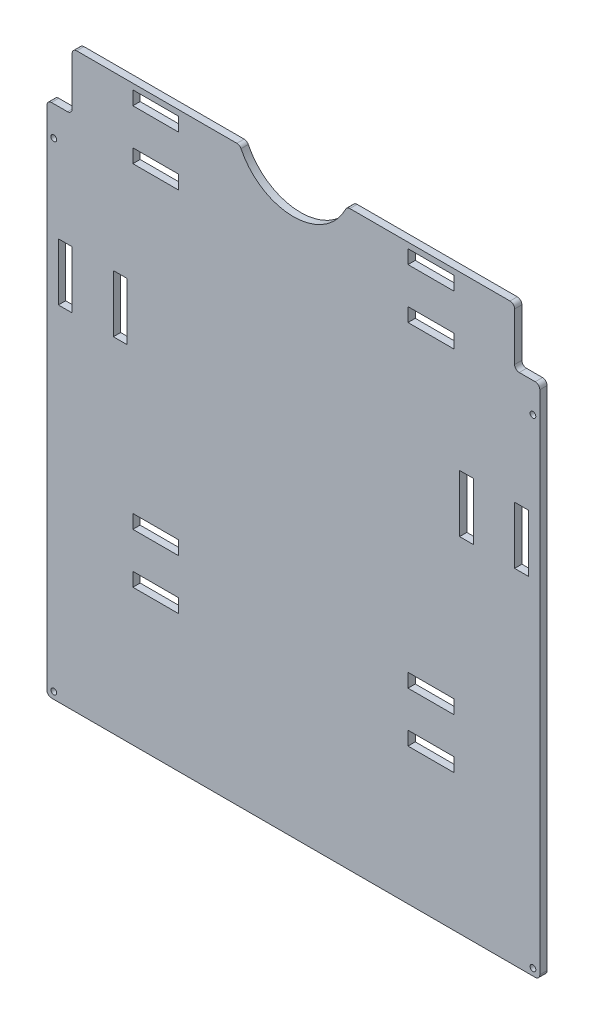
from build123d import *

# Parameters (mm, degrees)
SKETCH1_W                 = 215
SKETCH1_H                 = 250
BOSS_EXTRUDE1_DEPTH       = 3.175
SKETCH2_R                 = 25.4
CUT_EXTRUDE1_DEPTH        = 165.897940027
SKETCH3_W                 = 11
SKETCH3_H                 = 25
CUT_EXTRUDE2_DEPTH        = 165.897940027
FILLET1_R                 = 2
SKETCH4_W                 = 20
SKETCH4_H                 = 6
CUT_EXTRUDE3_DEPTH        = 165.897940027
LPATTERN1_COUNT           = 2
LPATTERN1_PITCH           = 160
LPATTERN1_COPY_1_SKETCH_W = 20
LPATTERN1_COPY_1_SKETCH_H = 6
LPATTERN1_COPY_1_DEPTH    = 165.897940027
M3X0_5_TAPPED_HOLE1_D     = 2.5
SKETCH9_W                 = 6
SKETCH9_H                 = 25
CUT_EXTRUDE4_DEPTH        = 165.897940027


with BuildPart() as part:
    # Sketch1 → Boss-Extrude1 (new body)
    with BuildSketch(Plane.XY):
        Rectangle(SKETCH1_W, SKETCH1_H)
    extrude(amount=BOSS_EXTRUDE1_DEPTH)

    # Sketch2 → Cut-Extrude1 (cut, through all)
    with BuildSketch(Plane.XY.offset(3.175)):
        with Locations((0, 135)):
            Circle(SKETCH2_R)
    extrude(amount=-CUT_EXTRUDE1_DEPTH, mode=Mode.SUBTRACT)

    # Sketch3 → Cut-Extrude2 (cut, through all)
    with BuildSketch(Plane.XY.offset(3.175)):
        with Locations((-102, 112.5)):
            Rectangle(SKETCH3_W, SKETCH3_H)
    cut_extrude2 = extrude(amount=-CUT_EXTRUDE2_DEPTH, mode=Mode.SUBTRACT)

    # Mirror1: Cut-Extrude2 across plane
    add(cut_extrude2.mirror(Plane(origin=(0, 0, 0), x_dir=(0, 0, 1), z_dir=(1, 0, 0))), mode=Mode.SUBTRACT)

    # Fillet1
    fillet1_edges = [part.edges().sort_by_distance(p)[0] for p in [
        (23.348661632, 125, 1.5875),
        (-23.348661632, 125, 1.5875),
        (-107.5, 100, 1.5875),
        (-96.5, 125, 1.5875),
        (-96.5, 100, 1.5875),
        (107.5, 100, 1.5875),
        (96.5, 100, 1.5875),
        (96.5, 125, 1.5875),
        (107.5, -125, 1.5875),
        (-107.5, -125, 1.5875),
    ]]
    fillet(fillet1_edges, radius=FILLET1_R)

    # Sketch4 → Cut-Extrude3 (cut, through all)
    with BuildSketch(Plane(origin=(0, 0, 0), x_dir=(-1, 0, 0), z_dir=(0, 0, -1))):
        with Locations((-60, -40.5)):
            Rectangle(SKETCH4_W, SKETCH4_H)
        with Locations((-60, -62.375)):
            Rectangle(SKETCH4_W, SKETCH4_H)
    cut_extrude3 = extrude(amount=-CUT_EXTRUDE3_DEPTH, mode=Mode.SUBTRACT)

    # Mirror2: Cut-Extrude3 across plane
    add(cut_extrude3.mirror(Plane(origin=(0, 0, 0), x_dir=(0, 0, 1), z_dir=(1, 0, 0))), mode=Mode.SUBTRACT)

    # LPattern1: Cut-Extrude3 ×2
    with Locations(*[(0, i * LPATTERN1_PITCH, 0) for i in range(1, LPATTERN1_COUNT)]):
        add(cut_extrude3, mode=Mode.SUBTRACT)

    # LPattern1 copy 1 sketch → LPattern1 copy 1 (cut, through all)
    with BuildSketch(Plane(origin=(0, 160, 0), x_dir=(1, 0, 0), z_dir=(0, 0, -1))):
        with Locations((-60, 40.5)):
            Rectangle(LPATTERN1_COPY_1_SKETCH_W, LPATTERN1_COPY_1_SKETCH_H)
        with Locations((-60, 62.375)):
            Rectangle(LPATTERN1_COPY_1_SKETCH_W, LPATTERN1_COPY_1_SKETCH_H)
    extrude(amount=-LPATTERN1_COPY_1_DEPTH, mode=Mode.SUBTRACT)

    # M3x0.5 Tapped Hole1 (through all)
    with Locations(Plane(origin=(0, 0, 0), x_dir=(-1, 0, 0), z_dir=(0, 0, -1))):
        with Locations((-104.5, 87), (104.5, 87), (104.5, -122), (-104.5, -122)):
            Hole(M3X0_5_TAPPED_HOLE1_D / 2)

    # Sketch9 → Cut-Extrude4 (cut, through all)
    with BuildSketch(Plane(origin=(0, 0, 0), x_dir=(-1, 0, 0), z_dir=(0, 0, -1))):
        with Locations((75.5, 37.5)):
            Rectangle(SKETCH9_W, SKETCH9_H)
        with Locations((99.5, 37.5)):
            Rectangle(SKETCH9_W, SKETCH9_H)
    cut_extrude4 = extrude(amount=-CUT_EXTRUDE4_DEPTH, mode=Mode.SUBTRACT)

    # Mirror3: Cut-Extrude4 across plane
    add(cut_extrude4.mirror(Plane(origin=(0, 0, 0), x_dir=(0, 0, 1), z_dir=(1, 0, 0))), mode=Mode.SUBTRACT)


solid = part.part
